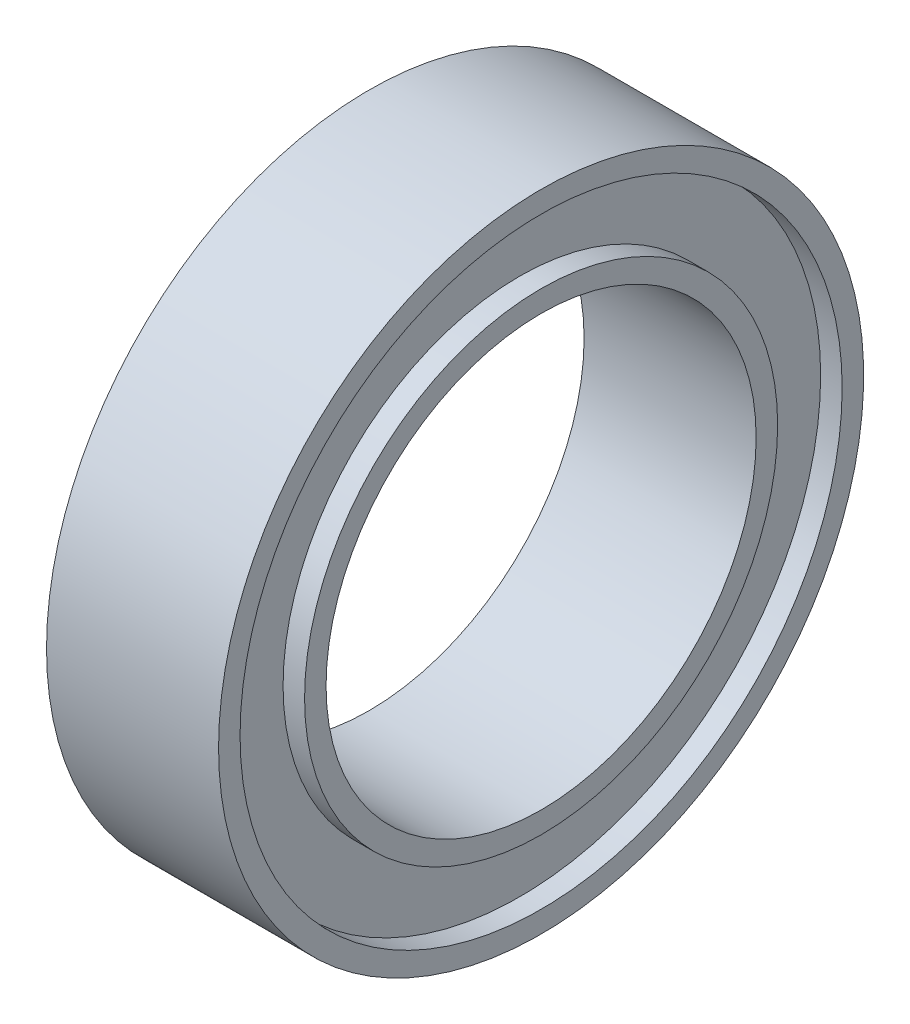
from build123d import *


with BuildPart() as part:
    # Esquisse1 → Révolution1 (revolve)
    with BuildSketch(Plane.XY, mode=Mode.PRIVATE) as r_volution1_sk:
        Polygon((1.5, 5.5), (2, 5.5), (2, 5), (-2, 5), (-2, 5.5), (-1.5, 5.5), (-1.5, 7), (-2, 7), (-2, 7.5), (2, 7.5), (2, 7), (1.5, 7), align=None)
    revolve(r_volution1_sk.sketch.rotate(Axis((-31.542820391, 0, 0), (1, 0, 0)), 90), axis=Axis((-31.542820391, 0, 0), (1, 0, 0)))


solid = part.part
